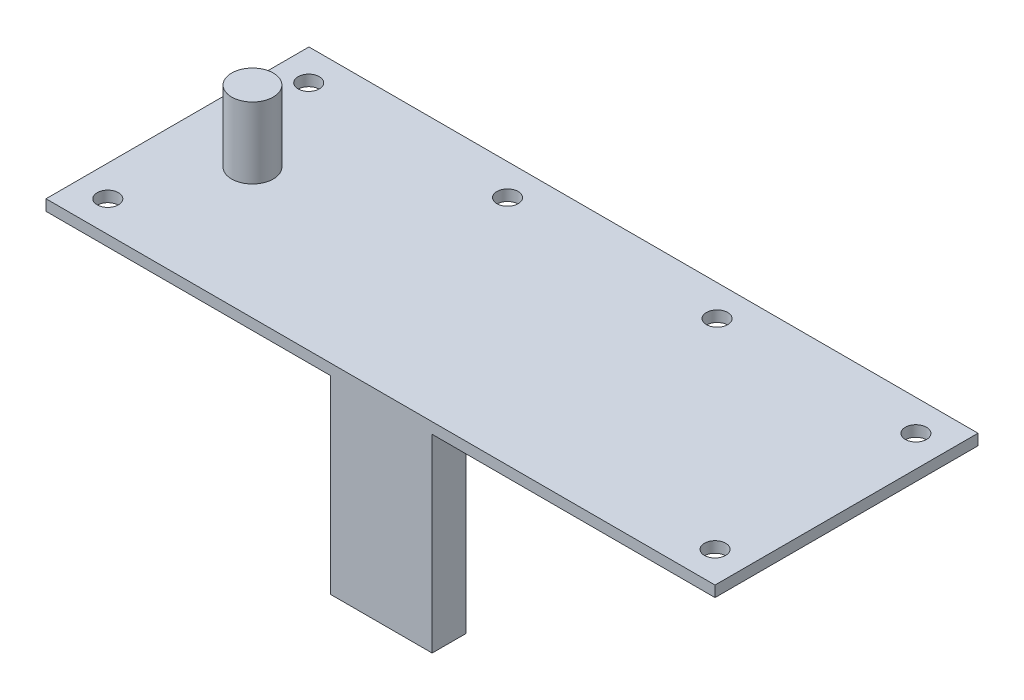
from build123d import *

# Parameters (mm, degrees)
SKETCH1_W           = 100.457
SKETCH1_H           = 39.4843
SKETCH1_R           = 1.59385
BOSS_EXTRUDE1_DEPTH = 1.6383
SKETCH3_R           = 3.1242
BOSS_EXTRUDE2_DEPTH = 10.668
SKETCH4_W           = 15.24
SKETCH4_H           = 5.08
BOSS_EXTRUDE3_DEPTH = 28.448


with BuildPart() as part:
    # Sketch1 → Boss-Extrude1 (new body)
    with BuildSketch(Plane(origin=(0, 0, 0), x_dir=(1, 0, 0), z_dir=(0, 1, 0))):
        with Locations((50.2285, 19.74215)):
            Rectangle(SKETCH1_W, SKETCH1_H)
        with Locations(Location((4.64185, 34.80435, 0), (0, 0, 90))):
            Circle(SKETCH1_R, mode=Mode.SUBTRACT)
        with Locations(Location((34.49955, 34.80435, 0), (0, 0, 90))):
            Circle(SKETCH1_R, mode=Mode.SUBTRACT)
        with Locations(Location((4.64185, 4.64185, 0), (0, 0, 90))):
            Circle(SKETCH1_R, mode=Mode.SUBTRACT)
        with Locations(Location((65.95745, 34.80435, 0), (0, 0, 90))):
            Circle(SKETCH1_R, mode=Mode.SUBTRACT)
        with Locations(Location((95.81515, 34.80435, 0), (0, 0, 90))):
            Circle(SKETCH1_R, mode=Mode.SUBTRACT)
        with Locations(Location((95.81515, 4.64185, 0), (0, 0, 90))):
            Circle(SKETCH1_R, mode=Mode.SUBTRACT)
    extrude(amount=BOSS_EXTRUDE1_DEPTH)

    # Sketch3 → Boss-Extrude2 (add)
    with BuildSketch(Plane(origin=(0, 1.6383, 0), x_dir=(1, 0, 0), z_dir=(0, 1, 0))):
        with Locations(Location((11.3792, 19.6215, 0), (0, 0, 90))):
            Circle(SKETCH3_R)
    extrude(amount=BOSS_EXTRUDE2_DEPTH)

    # Sketch4 → Boss-Extrude3 (add)
    with BuildSketch(Plane.XZ):
        with Locations((50.36185, -2.54)):
            Rectangle(SKETCH4_W, SKETCH4_H)
    extrude(amount=BOSS_EXTRUDE3_DEPTH)


solid = part.part
